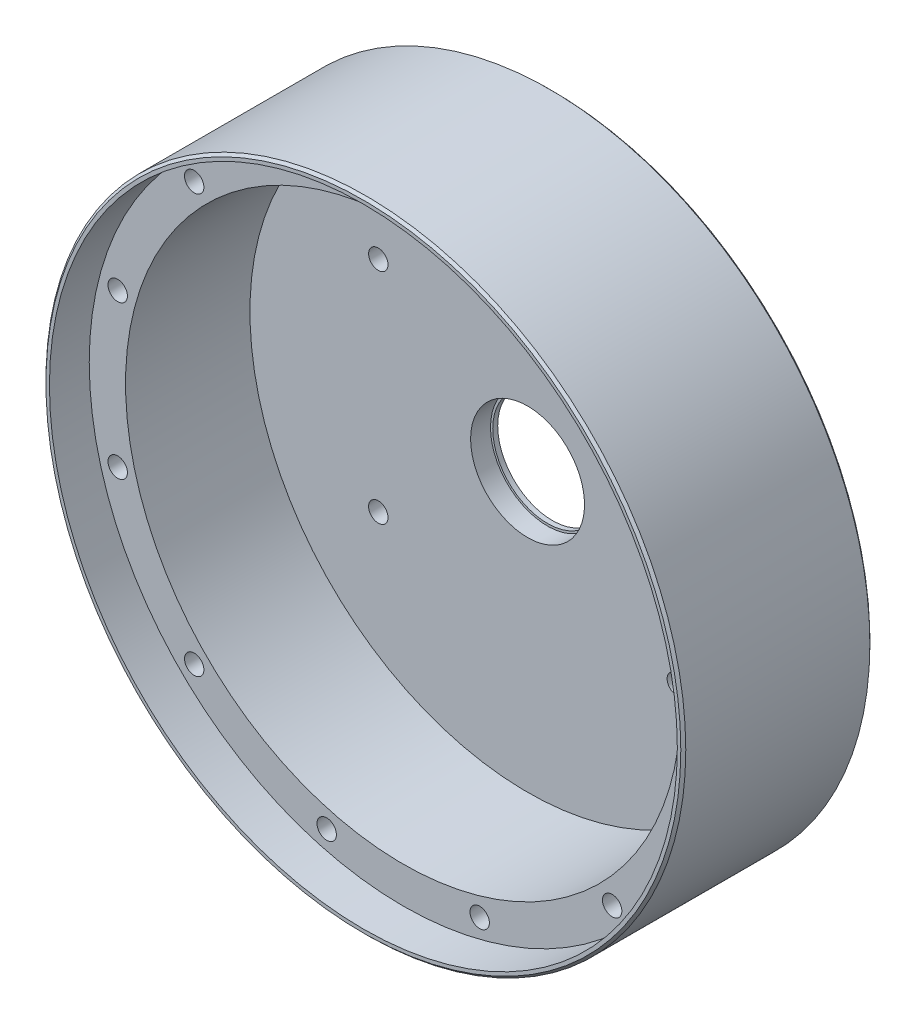
from build123d import *

# Parameters (mm, degrees)
ACTUATOR_HOUSING_MOUNT_R    = 64.3
ACTUATOR_HOUSING_MOUNT_R_2  = 55.8
ACTUATOR_HOUSING_MOUNT_R_3  = 1.6
ACTUATOR_HOUSING_WALL_DEPTH = 25
SKETCH2_R                   = 64.3
SKETCH2_R_2                 = 1.6
SKETCH2_R_3                 = 55.8
BOSS_EXTRUDE2_DEPTH         = 5
CUT_EXTRUDE1_START          = -5
SKETCH3_R                   = 11.45
CUT_EXTRUDE1_DEPTH          = 4
SKETCH4_R                   = 11
CUT_EXTRUDE2_DEPTH          = 4
BOSS_EXTRUDE3_START         = 8
SKETCH6_R                   = 64.3
SKETCH6_R_2                 = 63.1
BOSS_EXTRUDE3_DEPTH         = 8
SKETCH7_R                   = 1.95
M3_INSERT_L12_DEPTH         = 12
CHAMFER2_SIZE               = 0.5
SKETCH9_R                   = 1.95
CUT_EXTRUDE5_DEPTH          = 10


with BuildPart() as part:
    # Actuator Housing Mount → Actuator Housing Wall (new body)
    with BuildSketch(Plane.XY.offset(19)):
        Circle(ACTUATOR_HOUSING_MOUNT_R)
        Circle(ACTUATOR_HOUSING_MOUNT_R_2, mode=Mode.SUBTRACT)
        with Locations((57.375994082, 15.373851279)):
            Circle(ACTUATOR_HOUSING_MOUNT_R_3, mode=Mode.SUBTRACT)
        with Locations((57.375994082, -15.373851279)):
            Circle(ACTUATOR_HOUSING_MOUNT_R_3, mode=Mode.SUBTRACT)
        with Locations((42.002142802, -42.002142802)):
            Circle(ACTUATOR_HOUSING_MOUNT_R_3, mode=Mode.SUBTRACT)
        with Locations((15.373851279, -57.375994082)):
            Circle(ACTUATOR_HOUSING_MOUNT_R_3, mode=Mode.SUBTRACT)
        with Locations((-15.373851279, -57.375994082)):
            Circle(ACTUATOR_HOUSING_MOUNT_R_3, mode=Mode.SUBTRACT)
        with Locations((-42.002142802, -42.002142802)):
            Circle(ACTUATOR_HOUSING_MOUNT_R_3, mode=Mode.SUBTRACT)
        with Locations((-57.375994082, -15.373851279)):
            Circle(ACTUATOR_HOUSING_MOUNT_R_3, mode=Mode.SUBTRACT)
        with Locations((-57.375994082, 15.373851279)):
            Circle(ACTUATOR_HOUSING_MOUNT_R_3, mode=Mode.SUBTRACT)
        with Locations((-42.002142802, 42.002142802)):
            Circle(ACTUATOR_HOUSING_MOUNT_R_3, mode=Mode.SUBTRACT)
        with Locations((-15.373851279, 57.375994082)):
            Circle(ACTUATOR_HOUSING_MOUNT_R_3, mode=Mode.SUBTRACT)
        with Locations((15.373851279, 57.375994082)):
            Circle(ACTUATOR_HOUSING_MOUNT_R_3, mode=Mode.SUBTRACT)
        with Locations((42.002142802, 42.002142802)):
            Circle(ACTUATOR_HOUSING_MOUNT_R_3, mode=Mode.SUBTRACT)
    extrude(amount=-ACTUATOR_HOUSING_WALL_DEPTH)

    # Sketch2 → Boss-Extrude2 (add)
    # profile 1 of 2: a face of its own
    with BuildSketch(Plane(origin=(0, 0, -6), x_dir=(-1, 0, 0), z_dir=(0, 0, -1))):
        with Locations(Location((0, 0, 0), (0, 0, 180))):
            Circle(SKETCH2_R)
        with Locations(Location((-15.373851279, 57.375994082, 0), (0, 0, 180))):
            Circle(SKETCH2_R_2, mode=Mode.SUBTRACT)
        with Locations(Location((42.002142802, 42.002142802, 0), (0, 0, 180))):
            Circle(SKETCH2_R_2, mode=Mode.SUBTRACT)
        with Locations(Location((57.375994082, -15.373851279, 0), (0, 0, 180))):
            Circle(SKETCH2_R_2, mode=Mode.SUBTRACT)
        with Locations(Location((15.373851279, -57.375994082, 0), (0, 0, 180))):
            Circle(SKETCH2_R_2, mode=Mode.SUBTRACT)
        with Locations(Location((-42.002142802, -42.002142802, 0), (0, 0, 180))):
            Circle(SKETCH2_R_2, mode=Mode.SUBTRACT)
        with Locations(Location((-57.375994082, -15.373851279, 0), (0, 0, 180))):
            Circle(SKETCH2_R_2, mode=Mode.SUBTRACT)
        with Locations(Location((-57.375994082, 15.373851279, 0), (0, 0, 180))):
            Circle(SKETCH2_R_2, mode=Mode.SUBTRACT)
        with Locations(Location((0, 0, 0), (0, 0, 180))):
            Circle(SKETCH2_R_3, mode=Mode.SUBTRACT)
        with Locations(Location((-15.373851279, -57.375994082, 0), (0, 0, 180))):
            Circle(SKETCH2_R_2, mode=Mode.SUBTRACT)
        with Locations(Location((42.002142802, -42.002142802, 0), (0, 0, 180))):
            Circle(SKETCH2_R_2, mode=Mode.SUBTRACT)
        with Locations(Location((57.375994082, 15.373851279, 0), (0, 0, 180))):
            Circle(SKETCH2_R_2, mode=Mode.SUBTRACT)
        with Locations(Location((15.373851279, 57.375994082, 0), (0, 0, 180))):
            Circle(SKETCH2_R_2, mode=Mode.SUBTRACT)
        with Locations(Location((-42.002142802, 42.002142802, 0), (0, 0, 180))):
            Circle(SKETCH2_R_2, mode=Mode.SUBTRACT)
    # profile 2 of 2: a face of its own
    with BuildSketch(Plane(origin=(0, 0, -6), x_dir=(-1, 0, 0), z_dir=(0, 0, -1))):
        with Locations(Location((0, 0, 0), (0, 0, 180))):
            Circle(SKETCH2_R_3)
    extrude(amount=BOSS_EXTRUDE2_DEPTH)

    # Sketch3 → Cut-Extrude1 (cut)
    with BuildSketch(Plane(origin=(0, 0, -11), x_dir=(-1, 0, 0), z_dir=(0, 0, -1)).offset(CUT_EXTRUDE1_START)):
        Circle(SKETCH3_R)
    extrude(amount=CUT_EXTRUDE1_DEPTH, mode=Mode.SUBTRACT)

    # Sketch4 → Cut-Extrude2 (cut)
    with BuildSketch(Plane(origin=(0, 0, -11), x_dir=(-1, 0, 0), z_dir=(0, 0, -1))):
        Circle(SKETCH4_R)
    extrude(amount=-CUT_EXTRUDE2_DEPTH, mode=Mode.SUBTRACT)

    # Sketch6 → Boss-Extrude3 (add)
    with BuildSketch(Plane.XY.offset(19).offset(BOSS_EXTRUDE3_START)):
        Circle(SKETCH6_R)
        Circle(SKETCH6_R_2, mode=Mode.SUBTRACT)
    extrude(amount=-BOSS_EXTRUDE3_DEPTH)

    # Sketch7 → M3 Insert L12 (cut)
    with BuildSketch(Plane.XY.offset(19)):
        with Locations((57.375994082, -15.373851279)):
            Circle(SKETCH7_R)
        with Locations((42.002142802, -42.002142802)):
            Circle(SKETCH7_R)
        with Locations((15.373851279, -57.375994082)):
            Circle(SKETCH7_R)
        with Locations((-15.373851279, -57.375994082)):
            Circle(SKETCH7_R)
        with Locations((-42.002142802, -42.002142802)):
            Circle(SKETCH7_R)
        with Locations((-57.375994082, -15.373851279)):
            Circle(SKETCH7_R)
        with Locations((-57.375994082, 15.373851279)):
            Circle(SKETCH7_R)
        with Locations((-42.002142802, 42.002142802)):
            Circle(SKETCH7_R)
        with Locations((-15.373851279, 57.375994082)):
            Circle(SKETCH7_R)
        with Locations((15.373851279, 57.375994082)):
            Circle(SKETCH7_R)
        with Locations((42.002142802, 42.002142802)):
            Circle(SKETCH7_R)
        with Locations((57.375994082, 15.373851279)):
            Circle(SKETCH7_R)
    extrude(amount=-M3_INSERT_L12_DEPTH, mode=Mode.SUBTRACT)

    # Chamfer2
    chamfer2_edges = [part.edges().sort_by_distance(p)[0] for p in [
        (-64.3, 0, 27),
        (-64.3, 0, -11),
    ]]
    chamfer(chamfer2_edges, length=CHAMFER2_SIZE)

    # Sketch9 → Cut-Extrude5 (cut)
    with BuildSketch(Plane(origin=(0, 0, -11), x_dir=(-1, 0, 0), z_dir=(0, 0, -1))):
        with Locations((-30, 22)):
            Circle(SKETCH9_R)
        with Locations((30, 22)):
            Circle(SKETCH9_R)
        with Locations((30, -22)):
            Circle(SKETCH9_R)
        with Locations((-30, -22)):
            Circle(SKETCH9_R)
    extrude(amount=-CUT_EXTRUDE5_DEPTH, mode=Mode.SUBTRACT)


solid = part.part
